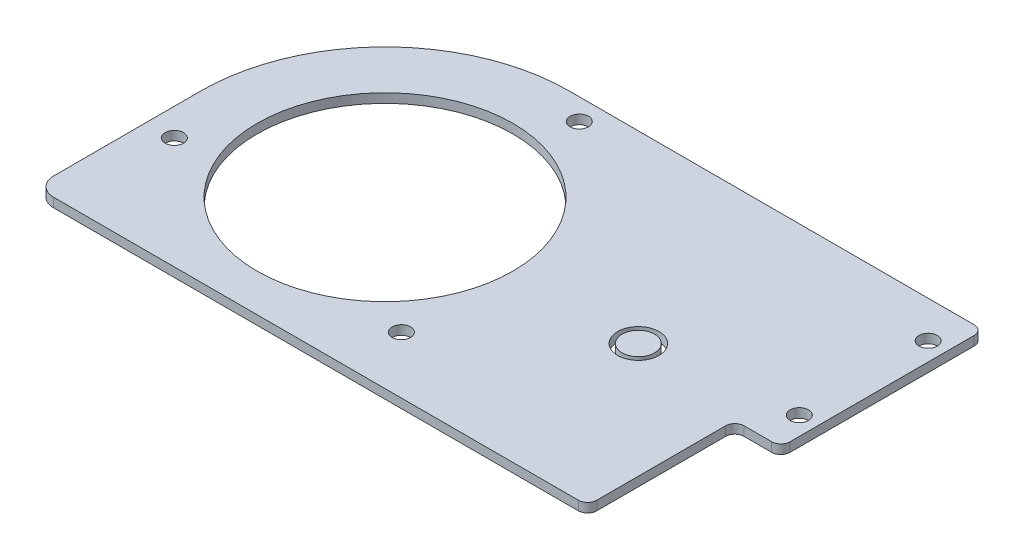
from build123d import *

# Parameters (mm, degrees)
SKETCH1_R           = 88.265
SKETCH1_R_2         = 6.35
BOSS_EXTRUDE1_DEPTH = 6.35
SKETCH6_R           = 14.2875
SKETCH6_R_2         = 11.176
CUT_EXTRUDE1_DEPTH  = 28.448


with BuildPart() as part:
    # Sketch1 → Boss-Extrude1 (new body)
    with BuildSketch(Plane(origin=(0, 0, 0), x_dir=(1, 0, 0), z_dir=(0, 1, 0))):
        with BuildLine():
            Line((279.4, 127), (0, 127))
            ThreePointArc((0, 127), (-89.802561211, 89.802561211), (-127, 0))
            Line((-127, 0), (-127, -101.6))
            ThreePointArc((-127, -101.6), (-123.280256121, -110.580256121), (-114.3, -114.3))
            Line((-114.3, -114.3), (247.65, -114.3))
            ThreePointArc((247.65, -114.3), (252.140128061, -112.440128061), (254, -107.95))
            Line((254, -107.95), (254, -19.05))
            ThreePointArc((254, -19.05), (255.859871939, -14.559871939), (260.35, -12.7))
            Line((260.35, -12.7), (279.4, -12.7))
            ThreePointArc((279.4, -12.7), (283.890128061, -10.840128061), (285.75, -6.35))
            Line((285.75, -6.35), (285.75, 120.65))
            ThreePointArc((285.75, 120.65), (283.890128061, 125.140128061), (279.4, 127))
        make_face()
        with Locations(Location((0, 0, 0), (0, 0, 270))):
            Circle(SKETCH1_R, mode=Mode.SUBTRACT)
        with Locations(Location((-108.072773191, -37.212440054, 0), (0, 0, 270))):
            Circle(SKETCH1_R_2, mode=Mode.SUBTRACT)
        with Locations(Location((21.809468172, 112.199987068, 0), (0, 0, 270))):
            Circle(SKETCH1_R_2, mode=Mode.SUBTRACT)
        with Locations(Location((86.263305019, -74.987547014, 0), (0, 0, 270))):
            Circle(SKETCH1_R_2, mode=Mode.SUBTRACT)
        with Locations(Location((273.05, 101.6, 0), (0, 0, 270))):
            Circle(SKETCH1_R_2, mode=Mode.SUBTRACT)
        with Locations(Location((273.05, 12.7, 0), (0, 0, 270))):
            Circle(SKETCH1_R_2, mode=Mode.SUBTRACT)
    extrude(amount=BOSS_EXTRUDE1_DEPTH)

    # Sketch6 → Cut-Extrude1 (cut)
    with BuildSketch(Plane(origin=(0, 0, 0), x_dir=(1, 0, 0), z_dir=(0, 1, 0))):
        with Locations(Location((174.752, 0, 0), (0, 0, 90))):
            Circle(SKETCH6_R)
        with Locations(Location((174.752, 0, 0), (0, 0, 90))):
            Circle(SKETCH6_R_2, mode=Mode.SUBTRACT)
    extrude(amount=CUT_EXTRUDE1_DEPTH, mode=Mode.SUBTRACT)


with BuildPart() as cut_extrude1_piece_1:
    # of the separate pieces the step leaves, piece 1, a body of its own (cut_extrude1_pieces)
    add(part.part.solids().sort_by_distance((279.4, 0, -127))[0])


with BuildPart() as cut_extrude1_piece_2:
    # of the separate pieces the step leaves, piece 2, a body of its own (cut_extrude1_pieces)
    add(part.part.solids().sort_by_distance((174.752, 0, -11.176))[0])


solid = Compound([cut_extrude1_piece_1.part, cut_extrude1_piece_2.part])
